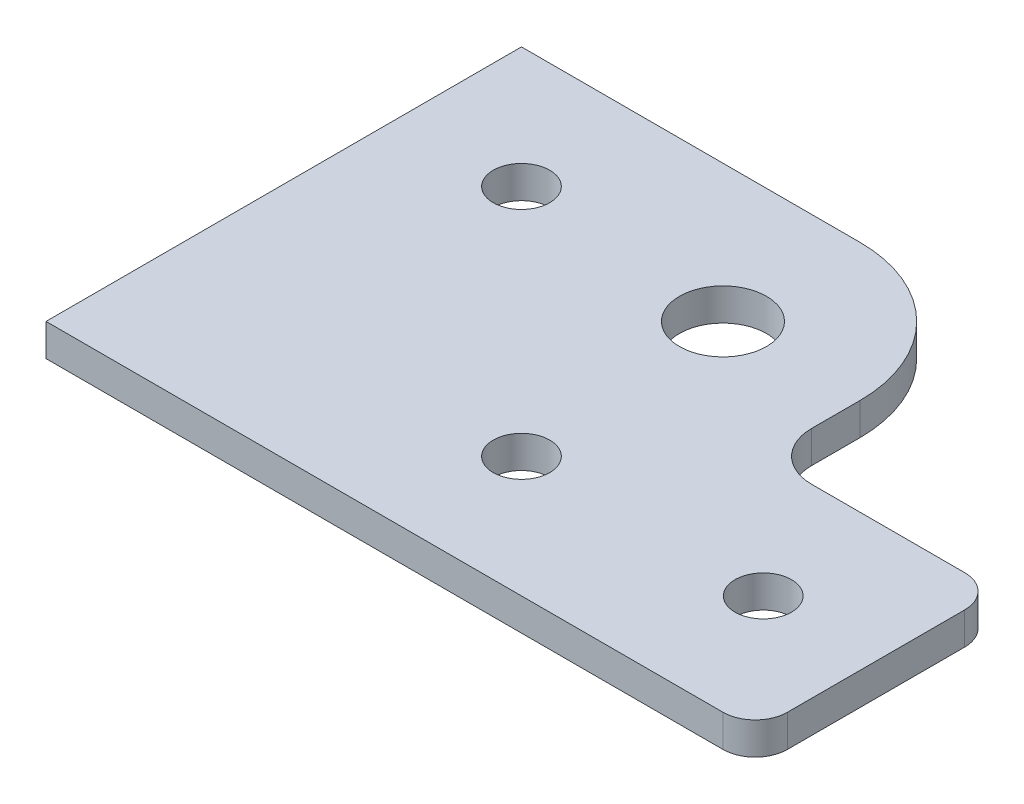
from build123d import *

# Parameters (mm, degrees)
SKETCH_1_R      = 1.75
SKETCH_1_R_2    = 5
EXTRUDE_1_DEPTH = 2
FILLET_1_R      = 3
EXTRUDE_START   = -2
SKETCH_2_R      = 5
SKETCH_2_R_2    = 2.7
EXTRUDE_2_DEPTH = 2
EXTRUDE_3_DEPTH = 2


with BuildPart() as part:
    # 草图1 → 凸台-拉伸1 (new body)
    with BuildSketch(Plane(origin=(0, 0, 0), x_dir=(1, 0, 0), z_dir=(0, 1, 0))):
        with BuildLine():
            Line((0, 27), (0, 0))
            Line((0, 0), (42, 0))
            ThreePointArc((42, 0), (43.414213562, 0.585786438), (44, 2))
            Line((44, 2), (44, 13))
            ThreePointArc((44, 13), (43.414213562, 14.414213562), (42, 15))
            Line((42, 15), (29.5, 15))
            Line((29.5, 15), (29.5, 21))
            ThreePointArc((29.5, 21), (27.01040764, 27.01040764), (21, 29.5))
            Line((21, 29.5), (0, 27))
        make_face()
        with Locations(Location((22, 7.5, 0), (0, 0, 270))):
            Circle(SKETCH_1_R, mode=Mode.SUBTRACT)
        with Locations(Location((37, 7.5, 0), (0, 0, 270))):
            Circle(SKETCH_1_R, mode=Mode.SUBTRACT)
        with Locations(Location((7.5, 22, 0), (0, 0, 270))):
            Circle(SKETCH_1_R, mode=Mode.SUBTRACT)
        with Locations(Location((21, 21, 0), (0, 0, 270))):
            Circle(SKETCH_1_R_2, mode=Mode.SUBTRACT)
    extrude(amount=EXTRUDE_1_DEPTH)

    # 圆角1
    fillet_1_edges = [part.edges().sort_by_distance(p)[0] for p in [
        (29.5, 1, -15),
    ]]
    fillet(fillet_1_edges, radius=FILLET_1_R)

    # 草图2 → 凸台-拉伸2 (add)
    with BuildSketch(Plane(origin=(0, 2, 0), x_dir=(1, 0, 0), z_dir=(0, 1, 0)).offset(EXTRUDE_START)):
        with Locations((21, 21)):
            Circle(SKETCH_2_R)
        with Locations(Location((21, 21, 0), (0, 0, 270))):
            Circle(SKETCH_2_R_2, mode=Mode.SUBTRACT)
    extrude(amount=EXTRUDE_2_DEPTH)

    # 草图3 → 凸台-拉伸3 (add)
    with BuildSketch(Plane(origin=(0, 2, 0), x_dir=(1, 0, 0), z_dir=(0, 1, 0))):
        Polygon((21, 29.5), (0, 29.5), (0, 27), align=None)
    extrude(amount=-EXTRUDE_3_DEPTH)


solid = part.part
